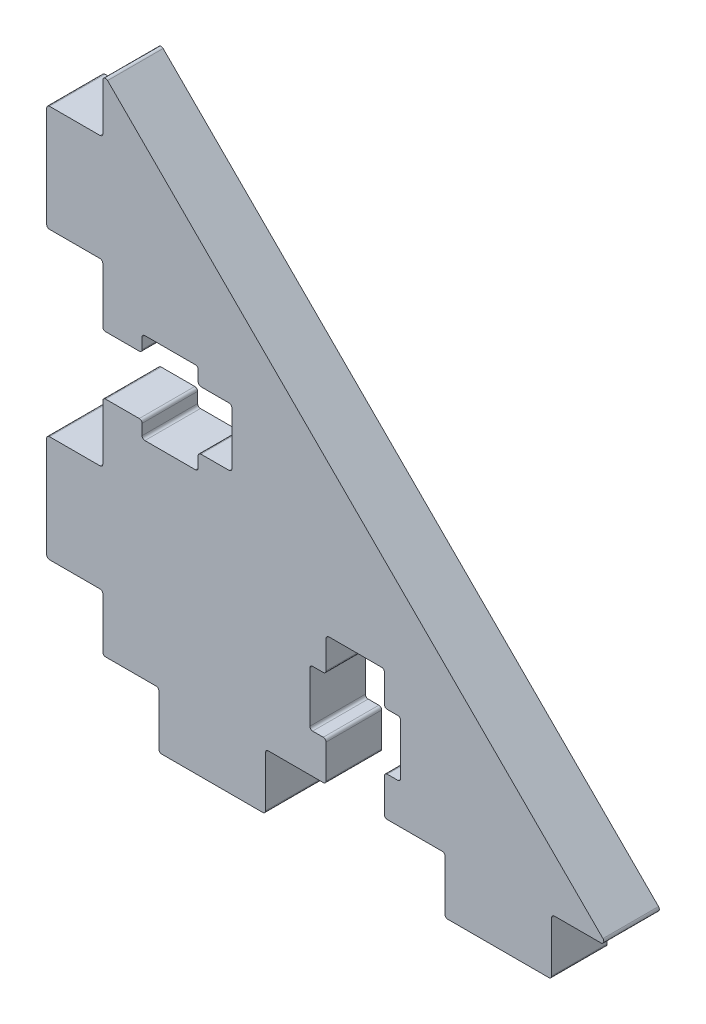
from build123d import *

# Parameters (mm, degrees)
BOSS_EXTRUDE1_DEPTH = 4.95
FILLET1_R           = 0.25
FILLET2_R           = 0.25


with BuildPart() as part:
    # Sketch2 → Boss-Extrude1 (new body)
    with BuildSketch(Plane.XY):
        Polygon((0, 45), (0, 40), (-5, 40), (-5, 30.5), (0, 30.5), (0, 25.1), (3.5, 25.1), (3.5, 26.55), (8.5, 26.55), (8.5, 25.1), (11.5, 25.1), (11.5, 19.9), (8.5, 19.9), (8.5, 18.45), (3.5, 18.45), (3.5, 19.9), (0, 19.9), (0, 14.5), (-5, 14.5), (-5, 5), (0, 5), (0, 0), (5, 0), (5, -5), (14.5, -5), (14.5, 0), (19.9, 0), (19.9, 3.5), (18.45, 3.5), (18.45, 8.5), (19.9, 8.5), (19.9, 11.5), (25.1, 11.5), (25.1, 8.5), (26.55, 8.5), (26.55, 3.5), (25.1, 3.5), (25.1, 0), (30.5, 0), (30.5, -5), (40, -5), (40, 0), (45, 0), align=None)
    extrude(amount=BOSS_EXTRUDE1_DEPTH)

    # Fillet1
    fillet1_edges = [part.edges().sort_by_distance(p)[0] for p in [
        (-5, 5, 2.475),
        (-5, 14.5, 2.475),
        (0, 19.9, 2.475),
        (0, 25.1, 2.475),
        (-5, 30.5, 2.475),
        (-5, 40, 2.475),
        (0, 45, 2.475),
        (45, 0, 2.475),
        (40, -5, 2.475),
        (30.5, -5, 2.475),
        (25.1, 0, 2.475),
        (19.9, 0, 2.475),
        (14.5, -5, 2.475),
        (5, -5, 2.475),
        (0, 0, 2.475),
    ]]
    fillet(fillet1_edges, radius=FILLET1_R)

    # Fillet2
    fillet2_edges = [part.edges().sort_by_distance(p)[0] for p in [
        (0, 5, 2.475),
        (0, 14.5, 2.475),
        (3.5, 19.9, 2.475),
        (3.5, 18.45, 2.475),
        (8.5, 18.45, 2.475),
        (8.5, 19.9, 2.475),
        (11.5, 19.9, 2.475),
        (11.5, 25.1, 2.475),
        (8.5, 25.1, 2.475),
        (8.5, 26.55, 2.475),
        (3.5, 26.55, 2.475),
        (3.5, 25.1, 2.475),
        (0, 30.5, 2.475),
        (0, 40, 2.475),
        (40, 0, 2.475),
        (30.5, 0, 2.475),
        (25.1, 3.5, 2.475),
        (26.55, 3.5, 2.475),
        (26.55, 8.5, 2.475),
        (25.1, 8.5, 2.475),
        (25.1, 11.5, 2.475),
        (19.9, 11.5, 2.475),
        (19.9, 8.5, 2.475),
        (18.45, 8.5, 2.475),
        (18.45, 3.5, 2.475),
        (19.9, 3.5, 2.475),
        (14.5, 0, 2.475),
        (5, 0, 2.475),
    ]]
    fillet(fillet2_edges, radius=FILLET2_R)


solid = part.part
